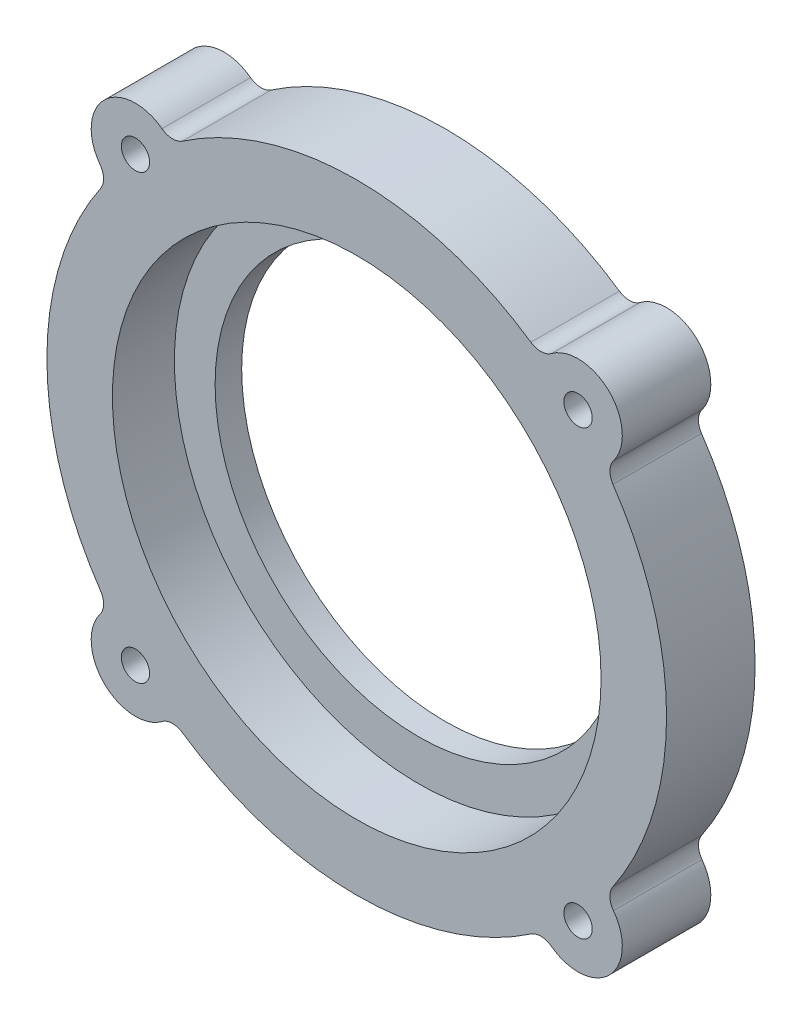
from build123d import *

# Parameters (mm, degrees)
SKETCH1_R           = 23
SKETCH1_R_2         = 1.6
BOSS_EXTRUDE1_DEPTH = 10
SKETCH2_R           = 27.6
CUT_EXTRUDE1_DEPTH  = 7


with BuildPart() as part:
    # Sketch1 → Boss-Extrude1 (new body)
    with BuildSketch(Plane.XY):
        with BuildLine():
            ThreePointArc((-28.945945946, 19.675675676), (-35, 0), (-28.945945946, -19.675675676))
            ThreePointArc((-28.945945946, -19.675675676), (-28.600540614, -20.846499055), (-29, -22))
            ThreePointArc((-29, -22), (-28.535533906, -28.535533906), (-22, -29))
            ThreePointArc((-22, -29), (-20.846499055, -28.600540614), (-19.675675676, -28.945945946))
            ThreePointArc((-19.675675676, -28.945945946), (0, -35), (19.675675676, -28.945945946))
            ThreePointArc((19.675675676, -28.945945946), (20.846499055, -28.600540614), (22, -29))
            ThreePointArc((22, -29), (28.535533906, -28.535533906), (29, -22))
            ThreePointArc((29, -22), (28.600540614, -20.846499055), (28.945945946, -19.675675676))
            ThreePointArc((28.945945946, -19.675675676), (35, 0), (28.945945946, 19.675675676))
            ThreePointArc((28.945945946, 19.675675676), (28.600540614, 20.846499055), (29, 22))
            ThreePointArc((29, 22), (28.535533906, 28.535533906), (22, 29))
            ThreePointArc((22, 29), (20.846499055, 28.600540614), (19.675675676, 28.945945946))
            ThreePointArc((19.675675676, 28.945945946), (0, 35), (-19.675675676, 28.945945946))
            ThreePointArc((-19.675675676, 28.945945946), (-20.846499055, 28.600540614), (-22, 29))
            ThreePointArc((-22, 29), (-28.535533906, 28.535533906), (-29, 22))
            ThreePointArc((-29, 22), (-28.600540614, 20.846499055), (-28.945945946, 19.675675676))
        make_face()
        Circle(SKETCH1_R, mode=Mode.SUBTRACT)
        with Locations((-25, 25)):
            Circle(SKETCH1_R_2, mode=Mode.SUBTRACT)
        with Locations((25, 25)):
            Circle(SKETCH1_R_2, mode=Mode.SUBTRACT)
        with Locations((-25, -25)):
            Circle(SKETCH1_R_2, mode=Mode.SUBTRACT)
        with Locations((25, -25)):
            Circle(SKETCH1_R_2, mode=Mode.SUBTRACT)
    extrude(amount=BOSS_EXTRUDE1_DEPTH)

    # Sketch2 → Cut-Extrude1 (cut)
    with BuildSketch(Plane.XY.offset(10)):
        Circle(SKETCH2_R)
    extrude(amount=-CUT_EXTRUDE1_DEPTH, mode=Mode.SUBTRACT)


solid = part.part
